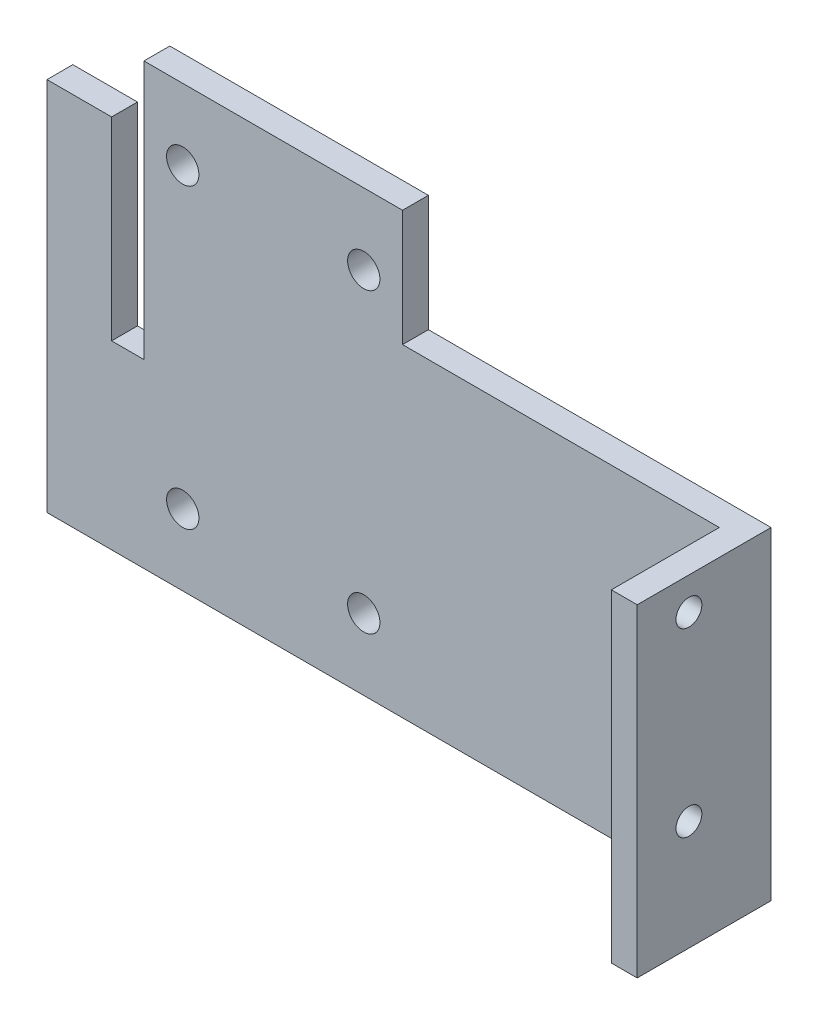
from build123d import *

# Parameters (mm, degrees)
SKETCH_1_R          = 2.5
EXTRUDE_1_DEPTH     = 4
SKETCH_2_W          = 4
SKETCH_2_H          = 50
EXTRUDE_2_DEPTH     = 16.7
SKETCH_3_R          = 2
CUT_EXTRUDE_1_DEPTH = 10
CUT_EXTRUDE_2_DEPTH = 10


with BuildPart() as part:
    # Эскиз1 → Бобышка-Вытянуть1 (new body)
    with BuildSketch(Plane.XY):
        Polygon((0, 0), (108, 0), (108, 50), (55, 50), (55, 68), (0, 68), align=None)
        with Locations((21, 57)):
            Circle(SKETCH_1_R, mode=Mode.SUBTRACT)
        with Locations((49, 57)):
            Circle(SKETCH_1_R, mode=Mode.SUBTRACT)
        with Locations((21, 11)):
            Circle(SKETCH_1_R, mode=Mode.SUBTRACT)
        with Locations((49, 11)):
            Circle(SKETCH_1_R, mode=Mode.SUBTRACT)
        with Locations((93, 25)):
            Circle(SKETCH_1_R, mode=Mode.SUBTRACT)
    extrude(amount=EXTRUDE_1_DEPTH)

    # Эскиз2 → Бобышка-Вытянуть2 (add)
    with BuildSketch(Plane.XY.offset(4)):
        with Locations((106, 25)):
            Rectangle(SKETCH_2_W, SKETCH_2_H)
    extrude(amount=EXTRUDE_2_DEPTH)

    # Эскиз3 → Вырез-Вытянуть1 (cut)
    with BuildSketch(Plane(origin=(108, 0, 0), x_dir=(0, 0, -1), z_dir=(1, 0, 0))):
        with Locations((-12.7, 45)):
            Circle(SKETCH_3_R)
        with Locations((-12.7, 17)):
            Circle(SKETCH_3_R)
    extrude(amount=-CUT_EXTRUDE_1_DEPTH, mode=Mode.SUBTRACT)

    # Эскиз4 → Вырез-Вытянуть2 (cut)
    with BuildSketch(Plane.XY.offset(4)):
        Polygon((0, 68), (15, 68), (15, 58), (15, 28), (10, 28), (10, 58), (0, 58), align=None)
    extrude(amount=-CUT_EXTRUDE_2_DEPTH, mode=Mode.SUBTRACT)


solid = part.part
